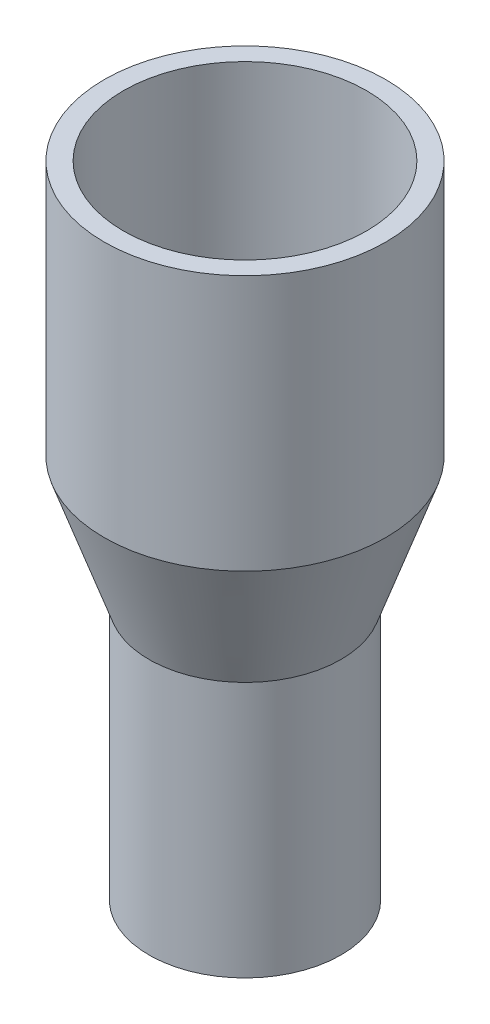
from build123d import *


with BuildPart() as part:
    # Sketch1 → Revolve1 (revolve)
    with BuildSketch(Plane.XY):
        Polygon((11, 25), (11, 5), (7.5, -5), (7.5, -25), (6, -25), (6, -4.745081407), (9.5, 5.254918593), (9.5, 25), align=None)
    revolve(axis=Axis((0, -25, 0), (0, 1, 0)))


solid = part.part
